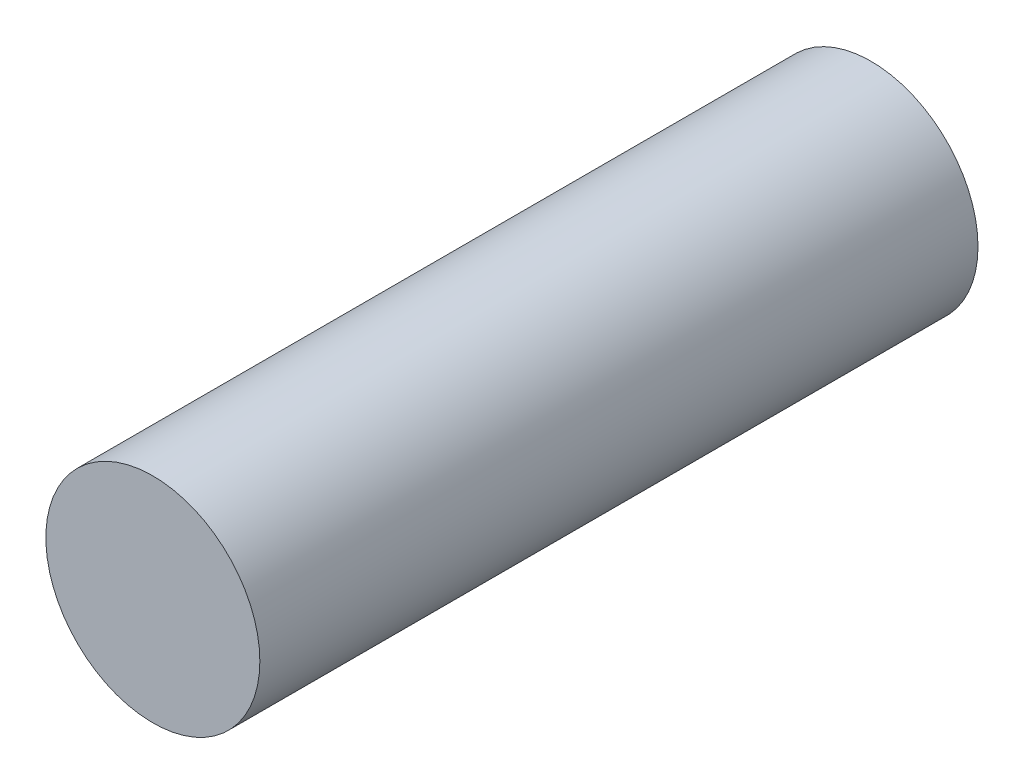
from build123d import *

# Parameters (mm, degrees)
SKETCH2_R           = 7.45
BOSS_EXTRUDE1_DEPTH = 50


with BuildPart() as part:
    # Sketch2 → Boss-Extrude1 (new body)
    with BuildSketch(Plane.XY):
        with Locations((-50.110514847, 18.005916752)):
            Circle(SKETCH2_R)
    extrude(amount=BOSS_EXTRUDE1_DEPTH)


solid = part.part
